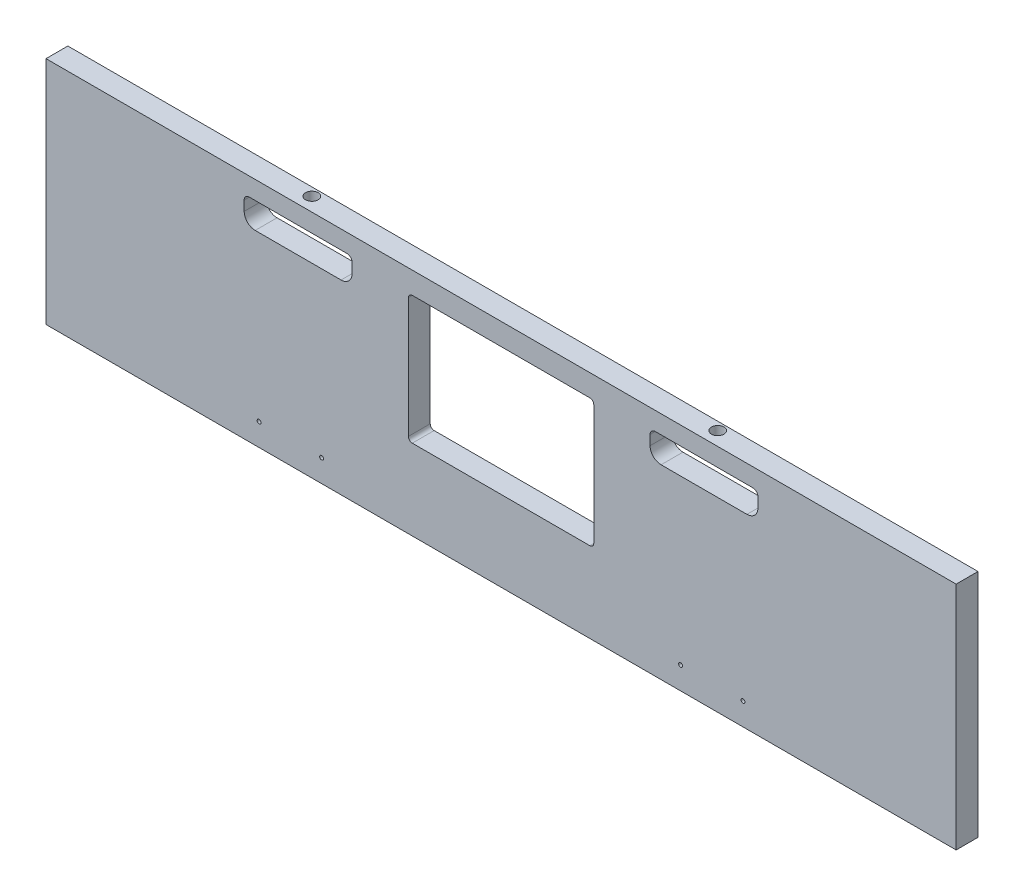
from build123d import *

# Parameters (mm, degrees)
SKETCH2_W          = 740.41
SKETCH2_H          = 187.325
EXTRUDE1_DEPTH     = 17.78
SKETCH3_R          = 1.5875
CUT_EXTRUDE1_DEPTH = 17.78
SKETCH4_R          = 5.08
CUT_EXTRUDE2_DEPTH = 14.859


with BuildPart() as part:
    # Sketch2 → Extrude1 (new body)
    with BuildSketch(Plane.XY):
        with Locations((-233.045, -5408.6125)):
            Rectangle(SKETCH2_W, SKETCH2_H)
    extrude(amount=-EXTRUDE1_DEPTH)

    # Sketch3 → Cut-Extrude1 (cut)
    with BuildSketch(Plane.XY):
        with Locations((-429.895, -5484.0124)):
            Circle(SKETCH3_R)
        with Locations((-379.095, -5484.0124)):
            Circle(SKETCH3_R)
        with Locations((-86.995, -5484.0124)):
            Circle(SKETCH3_R)
        with Locations((-36.195, -5484.0124)):
            Circle(SKETCH3_R)
        with BuildLine():
            Line((-308.45125, -5335.905), (-308.45125, -5433.695))
            ThreePointArc((-308.45125, -5433.695), (-307.52131403, -5435.94006403), (-305.27625, -5436.87))
            Line((-305.27625, -5436.87), (-160.81375, -5436.87))
            ThreePointArc((-160.81375, -5436.87), (-158.56868597, -5435.94006403), (-157.63875, -5433.695))
            Line((-157.63875, -5433.695), (-157.63875, -5335.905))
            ThreePointArc((-157.63875, -5335.905), (-158.56868597, -5333.65993597), (-160.81375, -5332.73))
            Line((-160.81375, -5332.73), (-305.27625, -5332.73))
            ThreePointArc((-305.27625, -5332.73), (-307.52131403, -5333.65993597), (-308.45125, -5335.905))
        make_face()
        with BuildLine():
            Line((-354.2665, -5334), (-354.2665, -5341.9375))
            ThreePointArc((-354.2665, -5341.9375), (-356.888919435, -5348.268580565), (-363.22, -5350.891))
            Line((-363.22, -5350.891), (-433.07, -5350.891))
            ThreePointArc((-433.07, -5350.891), (-439.401080565, -5348.268580565), (-442.0235, -5341.9375))
            Line((-442.0235, -5341.9375), (-442.0235, -5334))
            ThreePointArc((-442.0235, -5334), (-440.79598452, -5331.03651548), (-437.8325, -5329.809))
            Line((-437.8325, -5329.809), (-358.4575, -5329.809))
            ThreePointArc((-358.4575, -5329.809), (-355.49401548, -5331.03651548), (-354.2665, -5334))
        make_face()
        with BuildLine():
            Line((-102.87, -5350.891), (-33.02, -5350.891))
            ThreePointArc((-33.02, -5350.891), (-26.688919435, -5348.268580565), (-24.0665, -5341.9375))
            Line((-24.0665, -5341.9375), (-24.0665, -5334))
            ThreePointArc((-24.0665, -5334), (-25.29401548, -5331.03651548), (-28.2575, -5329.809))
            Line((-28.2575, -5329.809), (-107.6325, -5329.809))
            ThreePointArc((-107.6325, -5329.809), (-110.59598452, -5331.03651548), (-111.8235, -5334))
            Line((-111.8235, -5334), (-111.8235, -5341.9375))
            ThreePointArc((-111.8235, -5341.9375), (-109.201080565, -5348.268580565), (-102.87, -5350.891))
        make_face()
    extrude(amount=-CUT_EXTRUDE1_DEPTH, mode=Mode.SUBTRACT)

    # Sketch4 → Cut-Extrude2 (cut)
    with BuildSketch(Plane(origin=(0, -5314.95, 0), x_dir=(1, 0, 0), z_dir=(0, 1, 0))):
        with Locations(Location((-67.9699936, 11.187303, 0), (0, 0, 270))):
            Circle(SKETCH4_R)
        with Locations(Location((-398.1699936, 11.187303, 0), (0, 0, 270))):
            Circle(SKETCH4_R)
    extrude(amount=-CUT_EXTRUDE2_DEPTH, mode=Mode.SUBTRACT)


solid = part.part
